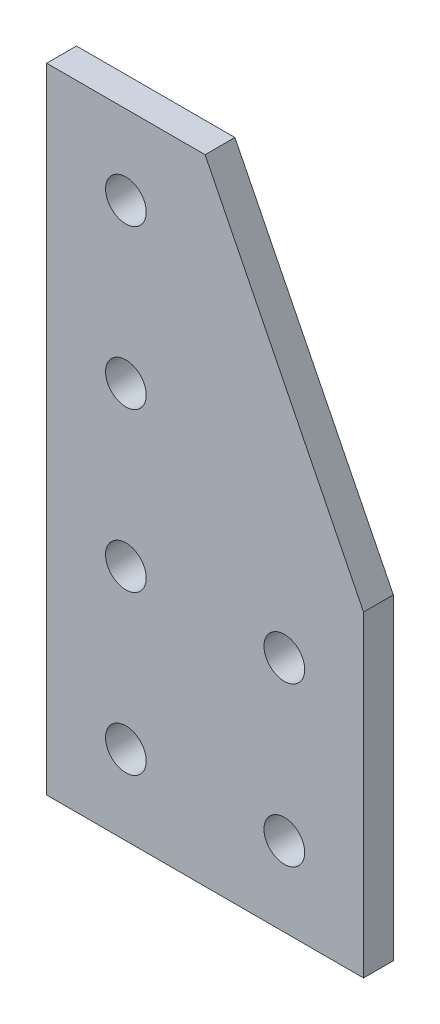
from build123d import *

# Parameters (mm, degrees)
BOSS_EXTRUDE1_DEPTH      = 2.3876
BOSS_EXTRUDE1_DEPTH_BACK = 2.3876
SKETCH4_R                = 3.2639
CUT_EXTRUDE1_DEPTH       = 57.996513359


with BuildPart() as part:
    # Sketch3 → Boss-Extrude1 (new, two sides: drawn at the far end of the back side and taken through both)
    with BuildSketch(Plane.XY.offset(-BOSS_EXTRUDE1_DEPTH_BACK)):
        Polygon((0, 50.8), (-25.4, 50.8), (-25.4, -50.8), (25.4, -50.8), (25.4, 0), align=None)
    extrude(amount=BOSS_EXTRUDE1_DEPTH + BOSS_EXTRUDE1_DEPTH_BACK)

    # Sketch4 → Cut-Extrude1 (cut, through all)
    with BuildSketch(Plane.XY.offset(2.3876)):
        with Locations((-12.7, -38.1)):
            Circle(SKETCH4_R)
        with Locations((12.7, -38.1)):
            Circle(SKETCH4_R)
        with Locations((12.7, -12.7)):
            Circle(SKETCH4_R)
        with Locations((-12.7, -12.7)):
            Circle(SKETCH4_R)
        with Locations((-12.7, 12.7)):
            Circle(SKETCH4_R)
        with Locations((-12.7, 38.1)):
            Circle(SKETCH4_R)
    extrude(amount=-CUT_EXTRUDE1_DEPTH, mode=Mode.SUBTRACT)


solid = part.part
